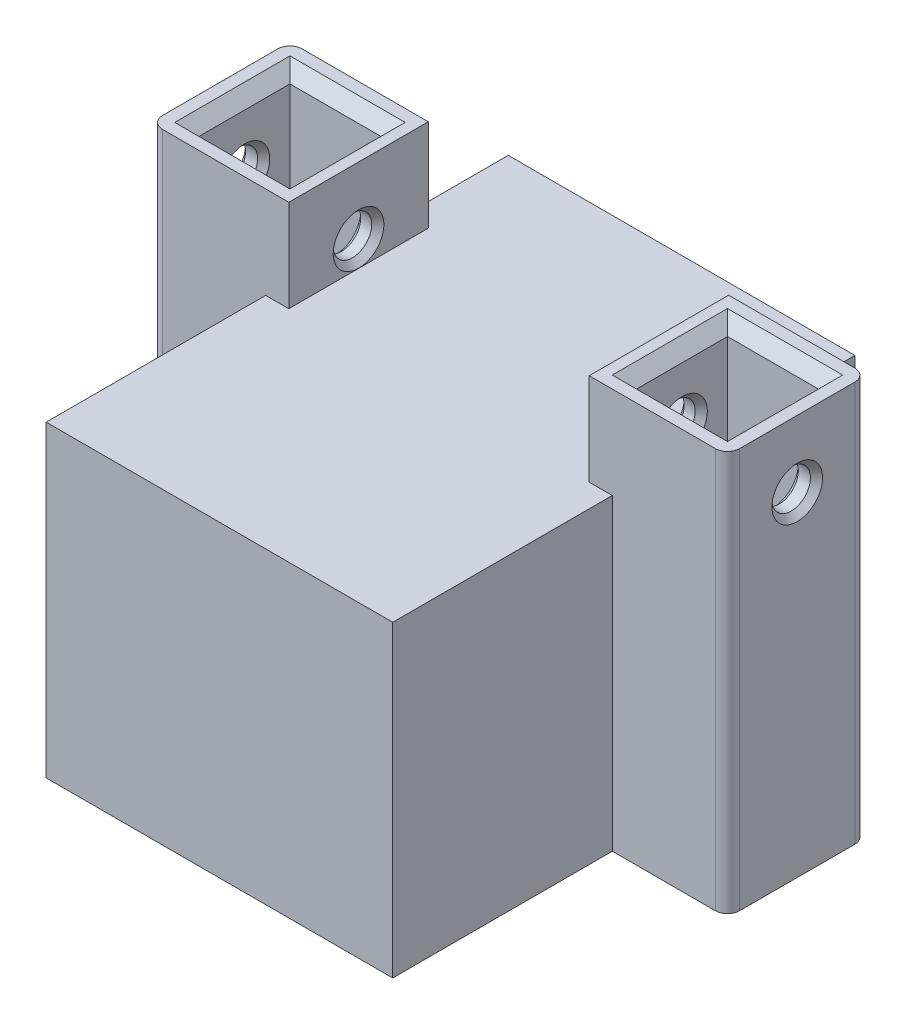
from build123d import *

# Parameters (mm, degrees)
SKETCH3_W                         = 57.15
SKETCH3_H                         = 76.2
BOSS_EXTRUDE2_DEPTH               = 50.8
SKETCH4_W                         = 49.53
SKETCH4_H                         = 68.58
CUT_EXTRUDE2_DEPTH                = 44.45
CUT_EXTRUDE3_REACH                = 109.95
SKETCH5_W                         = 9.398
SKETCH5_H                         = 11.43
MOTOR_MOUNTING_SHAPE_DEPTH        = 57.15
MOTOR_MOUNTING_HOLES_REACH        = 131.428
SKETCH8_R                         = 1.6
SKETCH7_W                         = 7.62
SKETCH7_H                         = 29.66
TRAY_SUPPORT_MOUNTING_SHAPE_DEPTH = 44.45
SKETCH9_W                         = 15
SKETCH9_H                         = 15
BOSS_EXTRUDE3_DEPTH               = 66
SKETCH10_R                        = 3.175
CUT_EXTRUDE4_DEPTH                = 133.062873284
CHAMFER1_SIZE                     = 2
FILLET1_R                         = 2
CHAMFER2_SIZE                     = 1
CUT_EXTRUDE5_DEPTH                = 120.104586394


with BuildPart() as part:
    # Sketch3 → Boss-Extrude2 (new body)
    with BuildSketch(Plane(origin=(0, 0, 0), x_dir=(-1, 0, 0), z_dir=(0, 1, 0))):
        with Locations((28.575, 38.1)):
            Rectangle(SKETCH3_W, SKETCH3_H)
    extrude(amount=-BOSS_EXTRUDE2_DEPTH)

    # Sketch4 → Cut-Extrude2 (cut)
    with BuildSketch(Plane.XZ.offset(50.8)):
        with Locations((-28.575, 38.1)):
            Rectangle(SKETCH4_W, SKETCH4_H)
    extrude(amount=-CUT_EXTRUDE2_DEPTH, mode=Mode.SUBTRACT)

    # Sketch5 → Cut-Extrude3 (cut, up to next)
    with BuildSketch(Plane(origin=(-57.15, 0, 0), x_dir=(0, 0, -1), z_dir=(1, 0, 0)), mode=Mode.PRIVATE) as cut_extrude3_sk1:
        with Locations((-9.779, -41.275)):
            Rectangle(SKETCH5_W, SKETCH5_H)
    cut_extrude3_tool1 = extrude(cut_extrude3_sk1.sketch, amount=CUT_EXTRUDE3_REACH, mode=Mode.PRIVATE) & part.part
    add(cut_extrude3_tool1.solids().sort_by_distance((-57.15, -41.275, 9.779))[0], mode=Mode.SUBTRACT)

    # Sketch6 → Motor Mounting Shape (add)
    with BuildSketch(Plane.ZY.offset(57.15)):
        Polygon((46.54, 0), (46.54, 36.83), (0, 36.83), (0, 34.29), (44, 34.29), (44, 0), align=None)
    extrude(amount=-MOTOR_MOUNTING_SHAPE_DEPTH)

    # Sketch8 → Motor-Mounting-Holes (cut, up to next)
    with BuildSketch(Plane(origin=(0, 36.83, 0), x_dir=(1, 0, 0), z_dir=(0, 1, 0)), mode=Mode.PRIVATE) as motor_mounting_holes_sk1:
        with Locations(Location((-44.075, -7.77, 0), (0, 0, 270))):
            Circle(SKETCH8_R)
    motor_mounting_holes_tool1 = extrude(motor_mounting_holes_sk1.sketch, amount=-MOTOR_MOUNTING_HOLES_REACH, mode=Mode.PRIVATE) & part.part
    # Sketch8 → Motor-Mounting-Holes (cut, up to next)
    with BuildSketch(Plane(origin=(0, 36.83, 0), x_dir=(1, 0, 0), z_dir=(0, 1, 0)), mode=Mode.PRIVATE) as motor_mounting_holes_sk2:
        with Locations(Location((-13.075, -7.77, 0), (0, 0, 270))):
            Circle(SKETCH8_R)
    motor_mounting_holes_tool2 = extrude(motor_mounting_holes_sk2.sketch, amount=-MOTOR_MOUNTING_HOLES_REACH, mode=Mode.PRIVATE) & part.part
    # Sketch8 → Motor-Mounting-Holes (cut, up to next)
    with BuildSketch(Plane(origin=(0, 36.83, 0), x_dir=(1, 0, 0), z_dir=(0, 1, 0)), mode=Mode.PRIVATE) as motor_mounting_holes_sk3:
        with Locations(Location((-13.075, -38.77, 0), (0, 0, 270))):
            Circle(SKETCH8_R)
    motor_mounting_holes_tool3 = extrude(motor_mounting_holes_sk3.sketch, amount=-MOTOR_MOUNTING_HOLES_REACH, mode=Mode.PRIVATE) & part.part
    # Sketch8 → Motor-Mounting-Holes (cut, up to next)
    with BuildSketch(Plane(origin=(0, 36.83, 0), x_dir=(1, 0, 0), z_dir=(0, 1, 0)), mode=Mode.PRIVATE) as motor_mounting_holes_sk4:
        with Locations(Location((-44.075, -38.77, 0), (0, 0, 270))):
            Circle(SKETCH8_R)
    motor_mounting_holes_tool4 = extrude(motor_mounting_holes_sk4.sketch, amount=-MOTOR_MOUNTING_HOLES_REACH, mode=Mode.PRIVATE) & part.part
    # Sketch8 → Motor-Mounting-Holes (cut, up to next)
    with BuildSketch(Plane(origin=(0, 36.83, 0), x_dir=(1, 0, 0), z_dir=(0, 1, 0)), mode=Mode.PRIVATE) as motor_mounting_holes_sk5:
        with BuildLine():
            Line((-37.465, 0), (-19.685, 0))
            Line((-19.685, 0), (-19.685, -23.27))
            ThreePointArc((-19.685, -23.27), (-28.575, -32.16), (-37.465, -23.27))
            Line((-37.465, -23.27), (-37.465, 0))
        make_face()
    motor_mounting_holes_tool5 = extrude(motor_mounting_holes_sk5.sketch, amount=-MOTOR_MOUNTING_HOLES_REACH, mode=Mode.PRIVATE) & part.part
    add(motor_mounting_holes_tool1.solids().sort_by_distance((-44.075, 36.83, 7.77))[0], mode=Mode.SUBTRACT)
    add(motor_mounting_holes_tool2.solids().sort_by_distance((-13.075, 36.83, 7.77))[0], mode=Mode.SUBTRACT)
    add(motor_mounting_holes_tool3.solids().sort_by_distance((-13.075, 36.83, 38.77))[0], mode=Mode.SUBTRACT)
    add(motor_mounting_holes_tool4.solids().sort_by_distance((-44.075, 36.83, 38.77))[0], mode=Mode.SUBTRACT)
    add(motor_mounting_holes_tool5.solids().sort_by_distance((-28.575, 36.83, 15.191166))[0], mode=Mode.SUBTRACT)

    # Sketch7 → Tray Support Mounting Shape (add)
    with BuildSketch(Plane(origin=(0, 0, 0), x_dir=(1, 0, 0), z_dir=(0, 1, 0))):
        with Locations((-42.545, -61.37)):
            Rectangle(SKETCH7_W, SKETCH7_H)
        with Locations((-14.605, -61.37)):
            Rectangle(SKETCH7_W, SKETCH7_H)
    extrude(amount=TRAY_SUPPORT_MOUNTING_SHAPE_DEPTH)

    # Sketch9 → Boss-Extrude3 (add)
    # profile 1 of 2: a face of its own
    with BuildSketch(Plane.XZ.offset(50.8)):
        Polygon((0, 40), (-3.81, 40), (-3.81, 17), (0, 17), (19, 17), (19, 40), align=None)
        with Locations((7.5, 28.5)):
            Rectangle(SKETCH9_W, SKETCH9_H, mode=Mode.SUBTRACT)
    # profile 2 of 2: a face of its own
    with BuildSketch(Plane.XZ.offset(50.8)):
        Polygon((-53.34, 17), (-57.15, 17), (-76.15, 17), (-76.15, 40), (-57.15, 40), (-53.34, 40), align=None)
        with Locations((-64.65, 28.5)):
            Rectangle(SKETCH9_W, SKETCH9_H, mode=Mode.SUBTRACT)
    extrude(amount=-BOSS_EXTRUDE3_DEPTH)

    # Sketch10 → Cut-Extrude4 (cut, through all)
    with BuildSketch(Plane.ZY.offset(76.15)):
        with Locations((28.5, 4.2)):
            Circle(SKETCH10_R)
    extrude(amount=-CUT_EXTRUDE4_DEPTH, mode=Mode.SUBTRACT)

    # Chamfer1
    chamfer1_edges = [part.edges().sort_by_distance(p)[0] for p in [
        (0, 15.2, 28.5),
        (7.5, 15.2, 36),
        (15, 15.2, 28.5),
        (7.5, 15.2, 21),
        (-64.65, 15.2, 36),
        (-72.15, 15.2, 28.5),
        (-64.65, 15.2, 21),
        (-57.15, 15.2, 28.5),
    ]]
    chamfer(chamfer1_edges, length=CHAMFER1_SIZE)

    # Fillet1
    fillet1_edges = [part.edges().sort_by_distance(p)[0] for p in [
        (19, -17.8, 17),
        (19, -17.8, 40),
        (-76.15, -17.8, 40),
        (-76.15, -17.8, 17),
    ]]
    fillet(fillet1_edges, radius=FILLET1_R)

    # Chamfer2
    chamfer2_edges = [part.edges().sort_by_distance(p)[0] for p in [
        (-57.15, 4.2, 25.325),
        (15, 4.2, 25.325),
        (0, 4.2, 25.325),
        (-3.81, 4.2, 25.325),
        (-53.34, 4.2, 25.325),
        (-72.15, 4.2, 25.325),
        (19, 4.2, 25.325),
        (-76.15, 4.2, 25.325),
    ]]
    chamfer(chamfer2_edges, length=CHAMFER2_SIZE)

    # Sketch11 → Cut-Extrude5 (cut, through all)
    with BuildSketch(Plane(origin=(0, 0, 0), x_dir=(0, 0, -1), z_dir=(1, 0, 0))):
        Polygon((-44, 0), (-44, 34.29), (0, 34.29), (0, 51.599341861), (-81.196180942, 51.599341861), (-81.196180942, 0), align=None)
    extrude(amount=-CUT_EXTRUDE5_DEPTH, mode=Mode.SUBTRACT)


solid = part.part
